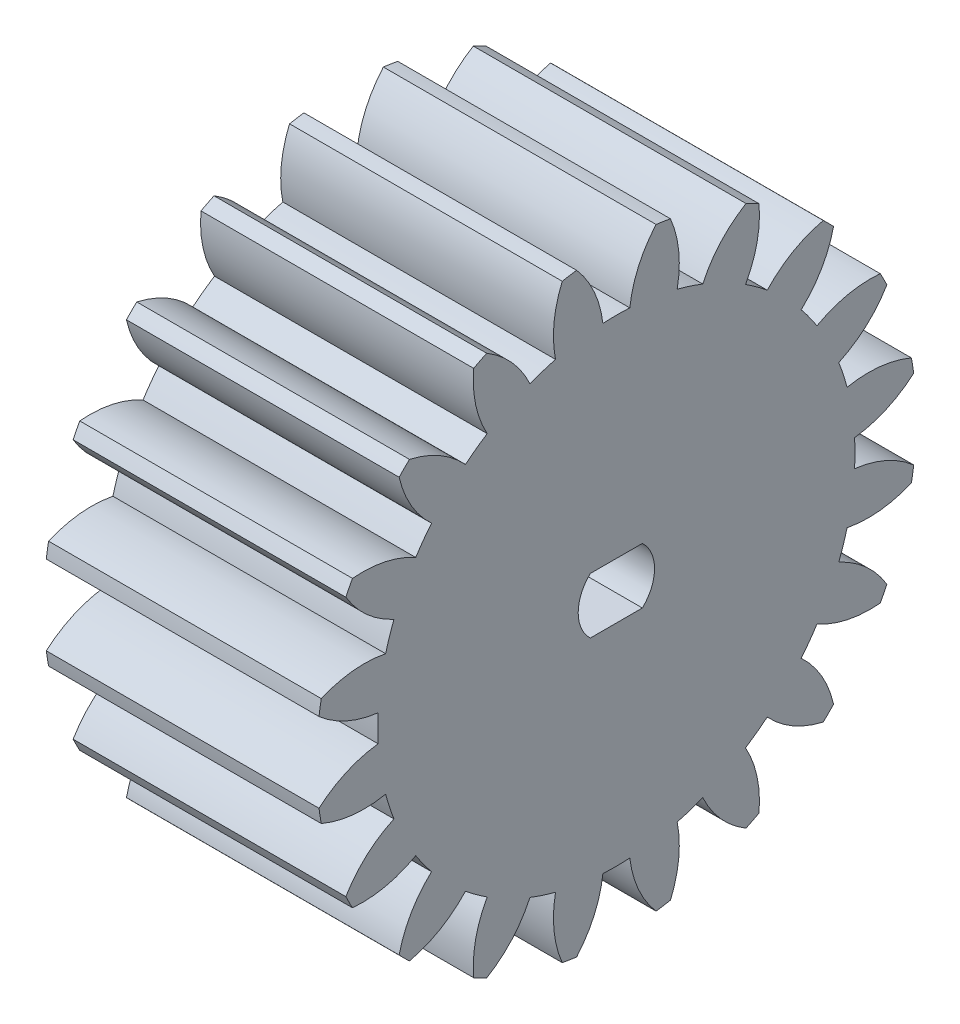
from build123d import *

# Parameters (mm, degrees)
BASPROSKE_W        = 20
BASPROSKE_H        = 22
TOOTHCUT_DEPTH     = 37.986484018
TEETHCUTS_COUNT    = 20
TEETHCUTS_ANGLE    = 342
CUT_EXTRUDE1_DEPTH = 37.75639264


with BuildPart() as part:
    # BasProSke → Base-Revolve (revolve)
    with BuildSketch(Plane(origin=(0, 0, 0), x_dir=(1, 0, 0), z_dir=(0, 1, 0)), mode=Mode.PRIVATE) as base_revolve_sk:
        with Locations((10, 11)):
            Rectangle(BASPROSKE_W, BASPROSKE_H)
    revolve(base_revolve_sk.sketch.rotate(Axis((-10, 0, 0), (1, 0, 0)), 180), axis=Axis((-10, 0, 0), (1, 0, 0)))

    # TooCutSke → ToothCut (cut, through all)
    with BuildSketch(Plane(origin=(0, 0, 0), x_dir=(0, 0, -1), z_dir=(1, 0, 0))):
        with BuildLine():
            ThreePointArc((0.986171591, 17.471189616), (0, 17.499), (-0.986171591, 17.471189616))
            ThreePointArc((-0.986171591, 17.471189616), (-1.626916196, 19.798789858), (-2.932850173, 21.829260982))
            ThreePointArc((-2.932850173, 21.829260982), (0, 22.0254), (2.932850173, 21.829260982))
            ThreePointArc((2.932850173, 21.829260982), (1.626916196, 19.798789858), (0.986171591, 17.471189616))
        make_face()
    toothcut = extrude(amount=TOOTHCUT_DEPTH, mode=Mode.SUBTRACT)

    # TeethCuts: ToothCut ×20 about axis
    teethcuts_axis = Axis((-10, 0, 0), (1, 0, 0))
    for i in range(1, TEETHCUTS_COUNT):
        add(toothcut.rotate(teethcuts_axis, i * TEETHCUTS_ANGLE / (TEETHCUTS_COUNT - 1)), mode=Mode.SUBTRACT)

    # Sketch1 → Cut-Extrude1 (cut, through all)
    with BuildSketch(Plane(origin=(20, 0, 0), x_dir=(0, 0, -1), z_dir=(1, 0, 0))):
        with BuildLine():
            Line((1.907223112, 2.05), (-1.907223112, 2.05))
            ThreePointArc((-1.907223112, 2.05), (-2.8, 0), (-1.907223112, -2.05))
            Line((-1.907223112, -2.05), (1.907223112, -2.05))
            ThreePointArc((1.907223112, -2.05), (2.567121415, -1.11798374), (2.8, 0))
            ThreePointArc((2.8, 0), (2.567121415, 1.11798374), (1.907223112, 2.05))
        make_face()
    extrude(amount=-CUT_EXTRUDE1_DEPTH, mode=Mode.SUBTRACT)


solid = part.part
